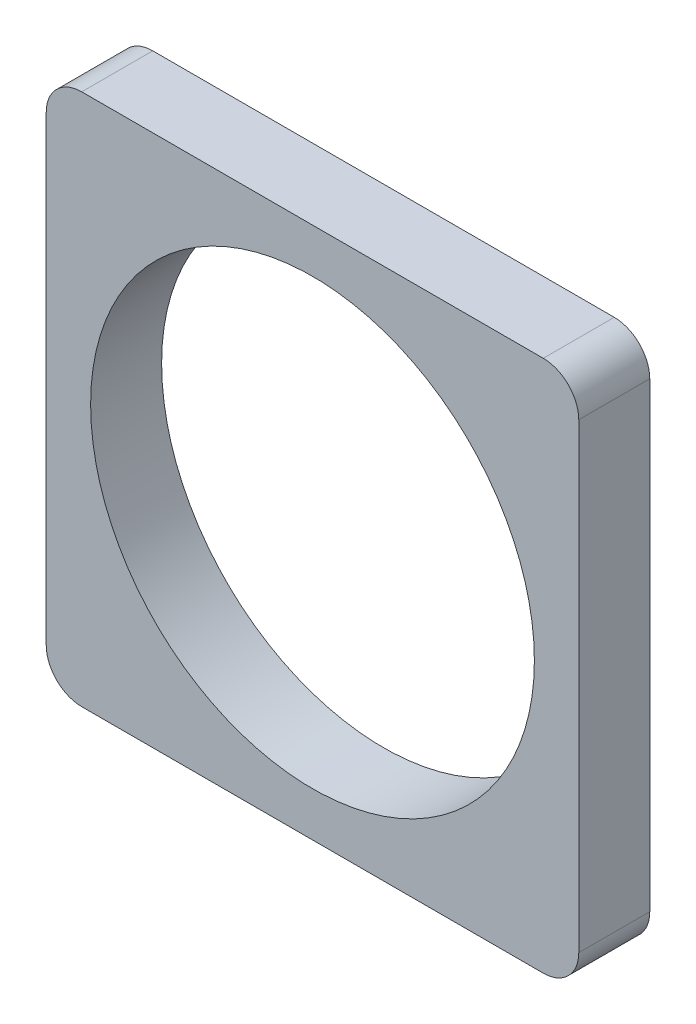
from build123d import *

# Parameters (mm, degrees)
SKETCH1_W           = 30
SKETCH1_H           = 30
SKETCH1_R           = 12.5
BOSS_EXTRUDE1_DEPTH = 4
FILLET1_R           = 2


with BuildPart() as part:
    # Sketch1 → Boss-Extrude1 (new body)
    with BuildSketch(Plane.XY):
        with Locations((15, 15)):
            Rectangle(SKETCH1_W, SKETCH1_H)
        with Locations((15, 15)):
            Circle(SKETCH1_R, mode=Mode.SUBTRACT)
    extrude(amount=BOSS_EXTRUDE1_DEPTH)

    # Fillet1
    fillet1_edges = [part.edges().sort_by_distance(p)[0] for p in [
        (0, 30, 2),
        (30, 30, 2),
        (30, 0, 2),
        (0, 0, 2),
    ]]
    fillet(fillet1_edges, radius=FILLET1_R)


solid = part.part
